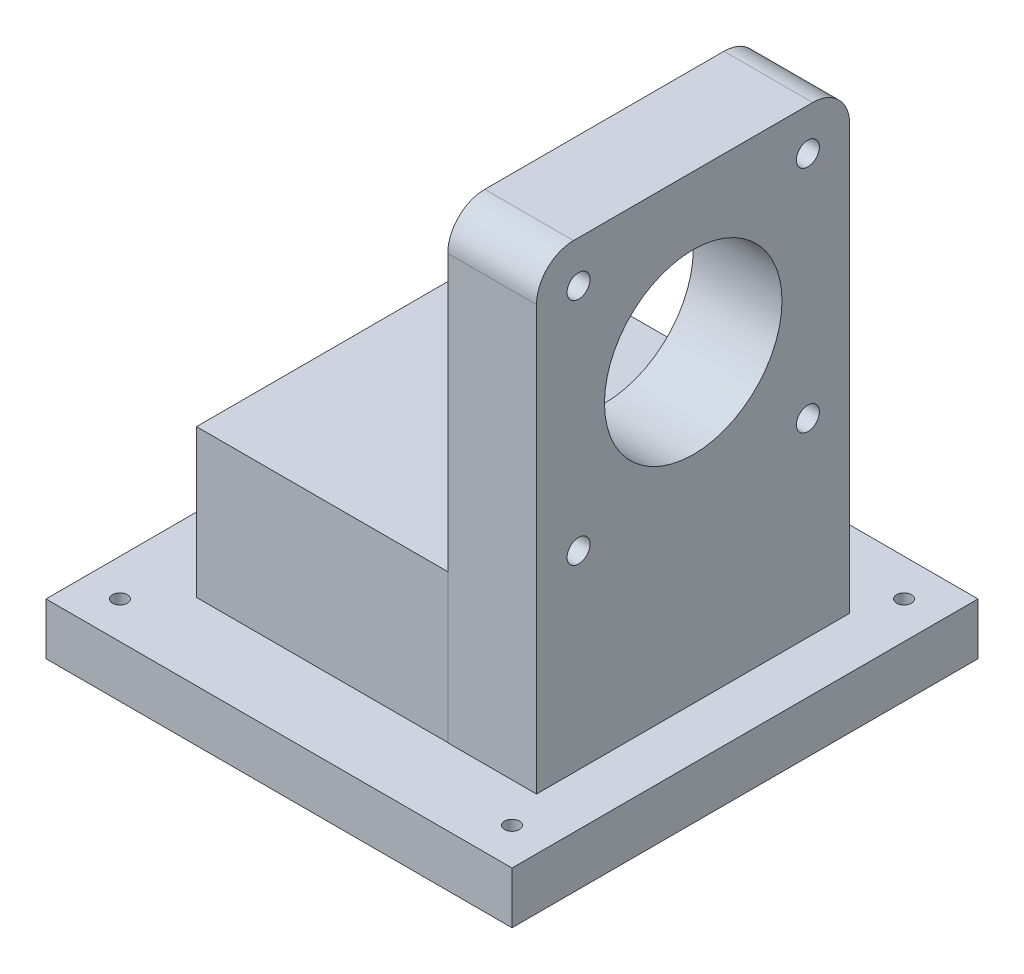
from build123d import *

# Parameters (mm, degrees)
SKETCH1_W              = 63
SKETCH1_H              = 63
BASE_PLATE_DEPTH       = 7
SKETCH4_W              = 34
SKETCH4_H              = 42.3
MAIN_SUPPORT_DEPTH     = 20
SKETCH5_W              = 12
SKETCH5_H              = 42.335
SCREW_SUPPORT_DEPTH    = 62.3
SKETCH6_R              = 12
SKETCH6_R_2            = 1.555
SCREW_DEPTH            = 50
SCREW_SUPPORT_FILLET_R = 5
BASE_SCREW_REACH       = 80.546
SKETCH7_R              = 1


with BuildPart() as part:
    # Sketch1 → Base Plate (new body)
    with BuildSketch(Plane(origin=(0, 0, 0), x_dir=(1, 0, 0), z_dir=(0, 1, 0))):
        with Locations((4.5, 0)):
            Rectangle(SKETCH1_W, SKETCH1_H)
    extrude(amount=BASE_PLATE_DEPTH)

    # Sketch4 → Main Support (add)
    with BuildSketch(Plane(origin=(0, 7, 0), x_dir=(1, 0, 0), z_dir=(0, 1, 0))):
        Rectangle(SKETCH4_W, SKETCH4_H)
    extrude(amount=MAIN_SUPPORT_DEPTH)

    # Sketch5 → Screw Support (add)
    with BuildSketch(Plane(origin=(0, 7, 0), x_dir=(1, 0, 0), z_dir=(0, 1, 0))):
        with Locations((23, -0.0175)):
            Rectangle(SKETCH5_W, SKETCH5_H)
    extrude(amount=SCREW_SUPPORT_DEPTH)

    # Sketch6 → Screw (cut)
    with BuildSketch(Plane(origin=(29, 0, 0), x_dir=(0, 0, -1), z_dir=(1, 0, 0))):
        with Locations((0, 48.15)):
            Circle(SKETCH6_R)
        with Locations((-15.5, 32.65)):
            Circle(SKETCH6_R_2)
        with Locations((15.5, 32.65)):
            Circle(SKETCH6_R_2)
        with Locations((15.5, 63.65)):
            Circle(SKETCH6_R_2)
        with Locations((-15.5, 63.65)):
            Circle(SKETCH6_R_2)
    extrude(amount=-SCREW_DEPTH, mode=Mode.SUBTRACT)

    # Screw Support Fillet
    screw_support_fillet_edges = [part.edges().sort_by_distance(p)[0] for p in [
        (23, 69.3, 21.185),
        (23, 69.3, -21.15),
    ]]
    fillet(screw_support_fillet_edges, radius=SCREW_SUPPORT_FILLET_R)

    # Sketch7 → Base Screw (cut, up to next)
    with BuildSketch(Plane(origin=(0, 7, 0), x_dir=(1, 0, 0), z_dir=(0, 1, 0)), mode=Mode.PRIVATE) as base_screw_sk1:
        with Locations(Location((-22, 26.5, 0), (0, 0, 270))):
            Circle(SKETCH7_R)
    base_screw_tool1 = extrude(base_screw_sk1.sketch, amount=-BASE_SCREW_REACH, mode=Mode.PRIVATE) & part.part
    # Sketch7 → Base Screw (cut, up to next)
    with BuildSketch(Plane(origin=(0, 7, 0), x_dir=(1, 0, 0), z_dir=(0, 1, 0)), mode=Mode.PRIVATE) as base_screw_sk2:
        with Locations(Location((31, 26.5, 0), (0, 0, 270))):
            Circle(SKETCH7_R)
    base_screw_tool2 = extrude(base_screw_sk2.sketch, amount=-BASE_SCREW_REACH, mode=Mode.PRIVATE) & part.part
    # Sketch7 → Base Screw (cut, up to next)
    with BuildSketch(Plane(origin=(0, 7, 0), x_dir=(1, 0, 0), z_dir=(0, 1, 0)), mode=Mode.PRIVATE) as base_screw_sk3:
        with Locations(Location((31, -26.5, 0), (0, 0, 270))):
            Circle(SKETCH7_R)
    base_screw_tool3 = extrude(base_screw_sk3.sketch, amount=-BASE_SCREW_REACH, mode=Mode.PRIVATE) & part.part
    # Sketch7 → Base Screw (cut, up to next)
    with BuildSketch(Plane(origin=(0, 7, 0), x_dir=(1, 0, 0), z_dir=(0, 1, 0)), mode=Mode.PRIVATE) as base_screw_sk4:
        with Locations(Location((-22, -26.5, 0), (0, 0, 270))):
            Circle(SKETCH7_R)
    base_screw_tool4 = extrude(base_screw_sk4.sketch, amount=-BASE_SCREW_REACH, mode=Mode.PRIVATE) & part.part
    add(base_screw_tool1.solids().sort_by_distance((-22, 7, -26.5))[0], mode=Mode.SUBTRACT)
    add(base_screw_tool2.solids().sort_by_distance((31, 7, -26.5))[0], mode=Mode.SUBTRACT)
    add(base_screw_tool3.solids().sort_by_distance((31, 7, 26.5))[0], mode=Mode.SUBTRACT)
    add(base_screw_tool4.solids().sort_by_distance((-22, 7, 26.5))[0], mode=Mode.SUBTRACT)


solid = part.part
